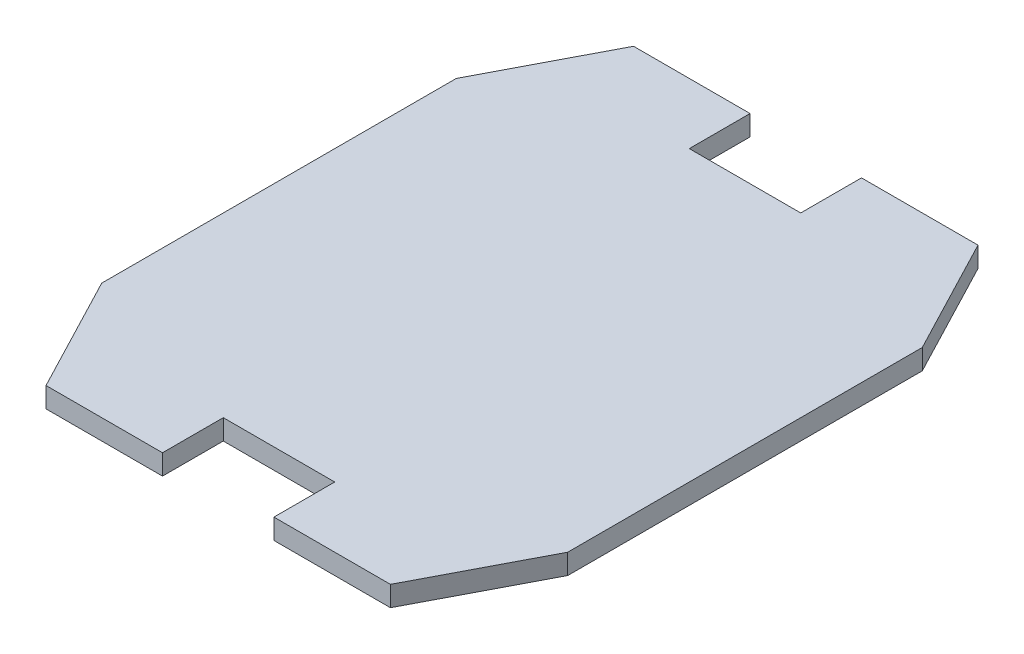
from build123d import *

# Parameters (mm, degrees)
SKETCH1_W           = 310
SKETCH1_H           = 290
BOSS_EXTRUDE1_DEPTH = 10
CUT_EXTRUDE1_DEPTH  = 213.485293609
SKETCH3_W           = 55
SKETCH3_H           = 30
CUT_EXTRUDE2_DEPTH  = 186.33752993


with BuildPart() as part:
    # Sketch1 → Boss-Extrude1 (new body)
    with BuildSketch(Plane(origin=(0, 0, 0), x_dir=(1, 0, 0), z_dir=(0, 1, 0))):
        Rectangle(SKETCH1_W, SKETCH1_H)
    extrude(amount=BOSS_EXTRUDE1_DEPTH)

    # Sketch2 → Cut-Extrude1 (cut, through all)
    with BuildSketch(Plane(origin=(0, 10, 0), x_dir=(1, 0, 0), z_dir=(0, 1, 0))):
        Polygon((-85, 145), (-115.000000002, 87.5), (-115.000000002, -87.5), (-85, -145), (-155, -145), (-155, 145), align=None)
        Polygon((155, -145), (155, 145), (85, 145), (115.000000002, 87.5), (115.000000002, -87.5), (85, -145), align=None)
    extrude(amount=-CUT_EXTRUDE1_DEPTH, mode=Mode.SUBTRACT)

    # Sketch3 → Cut-Extrude2 (cut, through all)
    with BuildSketch(Plane(origin=(0, 10, 0), x_dir=(1, 0, 0), z_dir=(0, 1, 0))):
        with Locations((0, 130)):
            Rectangle(SKETCH3_W, SKETCH3_H)
        with Locations((0, -130)):
            Rectangle(SKETCH3_W, SKETCH3_H)
    extrude(amount=-CUT_EXTRUDE2_DEPTH, mode=Mode.SUBTRACT)


solid = part.part
